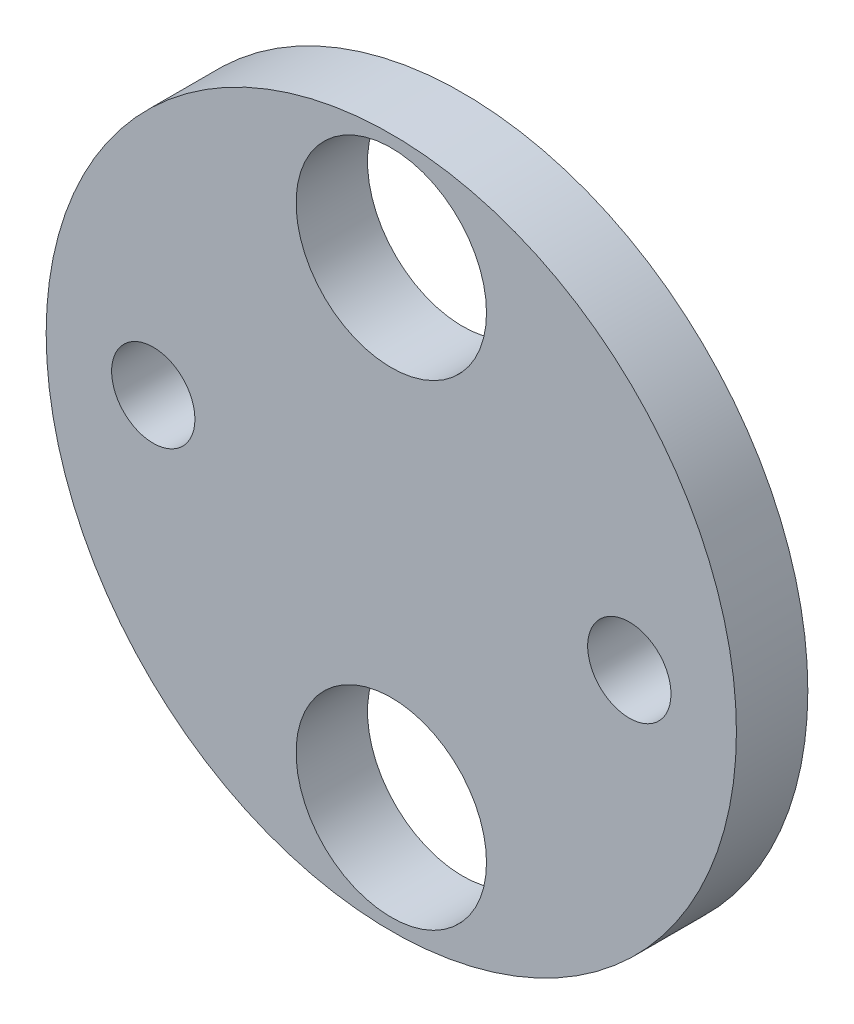
from build123d import *

# Parameters (mm, degrees)
SKETCH1_R           = 14.5
SKETCH1_R_2         = 1.75
SKETCH1_R_3         = 4
BOSS_EXTRUDE1_DEPTH = 3


with BuildPart() as part:
    # Sketch1 → Boss-Extrude1 (new body)
    with BuildSketch(Plane.XY):
        Circle(SKETCH1_R)
        with Locations((-10, 0)):
            Circle(SKETCH1_R_2, mode=Mode.SUBTRACT)
        with Locations((10, 0)):
            Circle(SKETCH1_R_2, mode=Mode.SUBTRACT)
        with Locations((0, -10)):
            Circle(SKETCH1_R_3, mode=Mode.SUBTRACT)
        with Locations((0, 10)):
            Circle(SKETCH1_R_3, mode=Mode.SUBTRACT)
    extrude(amount=BOSS_EXTRUDE1_DEPTH)


solid = part.part
